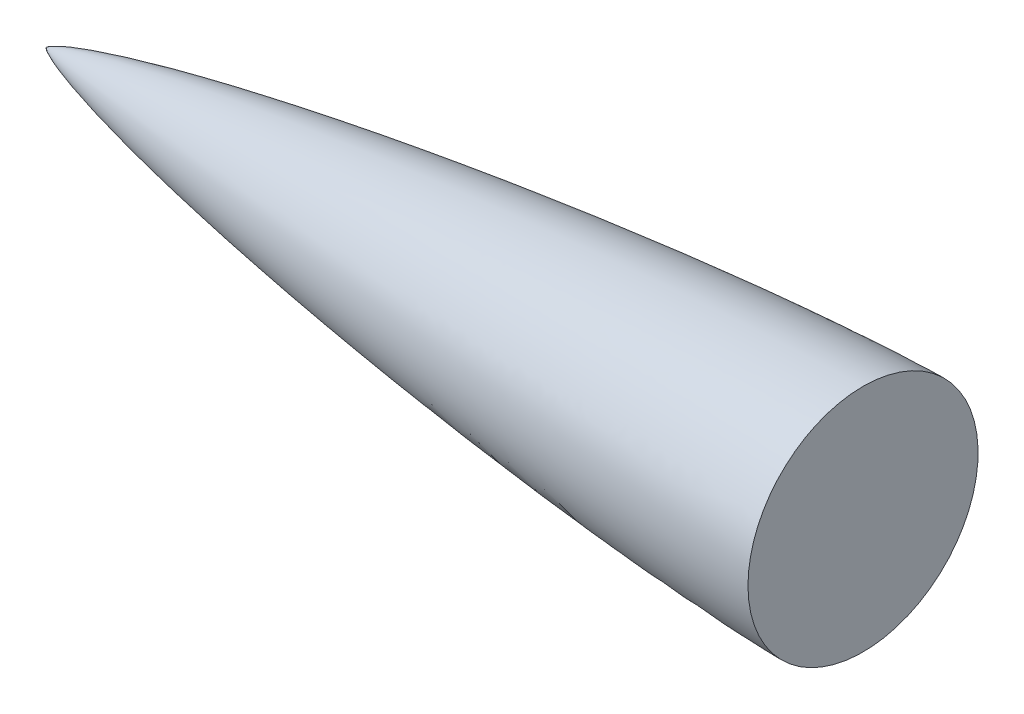
from build123d import *


with BuildPart() as part:
    # Sketch1 → Revolve1 (revolve)
    with BuildSketch(Plane.XY):
        with BuildLine():
            Line((0, 0), (600, 0))
            Line((600, 0), (600, 84.5))
            add(Edge.make_bspline(
                [(0, 0), (0.00153162, 0.006510857), (0.005376169, 0.019242352), (0.016436781, 0.04347782), (0.043799891, 0.089238459), (0.087268295, 0.148177127), (0.148103608, 0.218754829), (0.2660579, 0.340389674), (0.406372153, 0.465444665), (0.566521252, 0.595358113), (0.814117414, 0.780975633), (1.152842533, 1.015799242), (1.750292214, 1.392249528), (2.826027495, 1.996128068), (4.711982577, 2.931206398), (8.137767962, 4.417863213), (14.32600732, 6.746466907), (24.573809794, 10.073135304), (38.444765886, 13.989221552), (55.152307362, 18.204296209), (78.037084853, 23.470855968), (105.660510073, 29.230414635), (138.12802968, 35.37979853), (175.450520807, 41.80614442), (212.856624159, 47.723581823), (250.32992885, 53.198171442), (287.859557226, 58.271251189), (325.438230039, 62.966902998), (363.06074249, 67.297009471), (400.723448557, 71.262547271), (438.423758914, 74.853476048), (476.159975058, 78.04647884), (509.209738341, 80.454270833), (537.559805467, 82.193846268), (560.135873752, 83.323585704), (575.094746846, 83.927861205), (587.160763408, 84.297090638), (594.496994016, 84.446128279), (598.165584186, 84.493841516), (600, 84.5)],
                knots=[0, 0, 0, 0, 0, 4.3754e-05, 8.7508e-05, 0.000175017, 0.000350034, 0.00052505, 0.000700067, 0.001289315, 0.001585429, 0.001881543, 0.002735782, 0.004000397, 0.006229855, 0.009994935, 0.016580235, 0.028561626, 0.049716912, 0.080862988, 0.111393081, 0.141923173, 0.204215351, 0.266507543, 0.328799732, 0.391091921, 0.45338411, 0.515676301, 0.57796849, 0.64026068, 0.702552869, 0.764845059, 0.827137248, 0.889429439, 0.920575534, 0.951721629, 0.975860814, 0.987930407, 1, 1, 1, 1, 1], degree=4))
        make_face()
    revolve(axis=Axis((0, 0, 0), (1, 0, 0)))


solid = part.part
